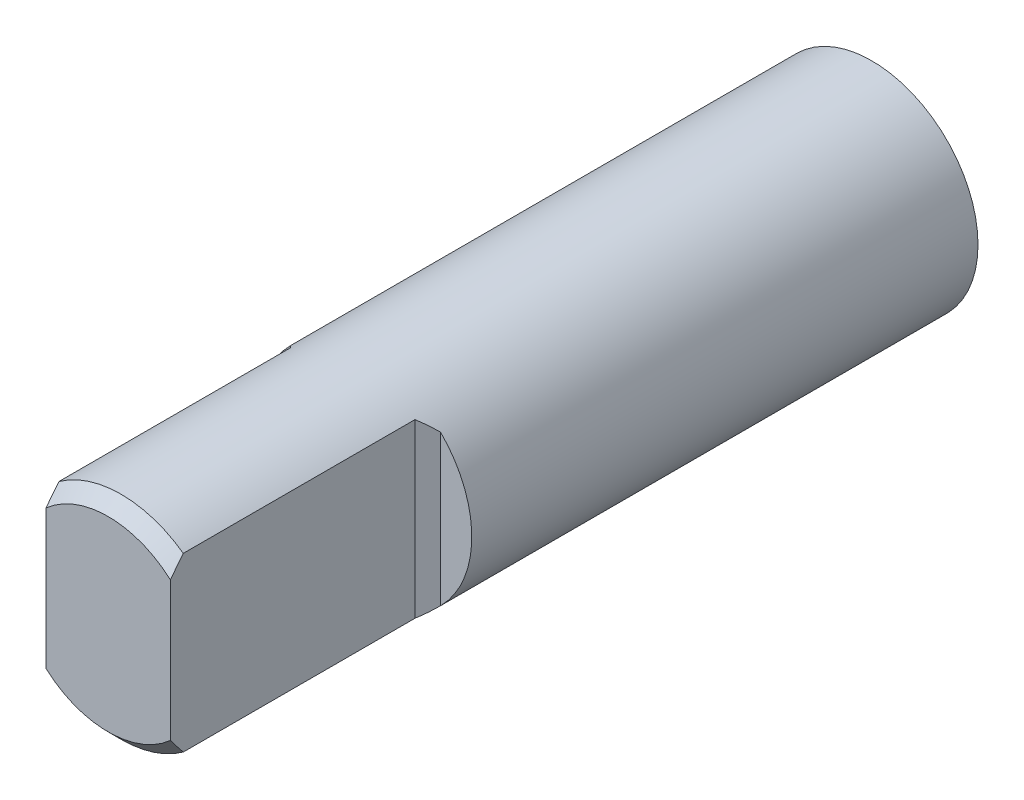
from build123d import *

# Parameters (mm, degrees)
SKETCH1_R           = 2.475
EXTRUDE1_DEPTH      = 17.8
SKETCH2_OUTSIDE_W   = 10.776
SKETCH2_OUTSIDE_H   = 10.776
SKETCH2_OUTSIDE_W_2 = 2.9
SKETCH2_OUTSIDE_H_2 = 7
EXTRUDE2_DEPTH      = 6
CHAMFER1_SIZE       = 0.3
CHAMFER2_SIZE       = 0.3


with BuildPart() as part:
    # Sketch1 → Extrude1 (new body)
    with BuildSketch(Plane.XY):
        Circle(SKETCH1_R)
    extrude(amount=EXTRUDE1_DEPTH)

    # Sketch2 outside → Extrude2 (cut)
    with BuildSketch(Plane.XY.offset(17.8)):
        Rectangle(SKETCH2_OUTSIDE_W, SKETCH2_OUTSIDE_H)
        Rectangle(SKETCH2_OUTSIDE_W_2, SKETCH2_OUTSIDE_H_2, mode=Mode.SUBTRACT)
    extrude(amount=-EXTRUDE2_DEPTH, mode=Mode.SUBTRACT)

    # Chamfer1
    chamfer1_edges = [part.edges().sort_by_distance(p)[0] for p in [
        (0, -2.475, 17.8),
        (0, 2.475, 17.8),
    ]]
    chamfer(chamfer1_edges, length=CHAMFER1_SIZE)

    # Chamfer2
    chamfer2_edges = [part.edges().sort_by_distance(p)[0] for p in [
        (-1.45, 0, 11.8),
        (1.45, 0, 11.8),
    ]]
    chamfer(chamfer2_edges, length=CHAMFER2_SIZE)


solid = part.part
